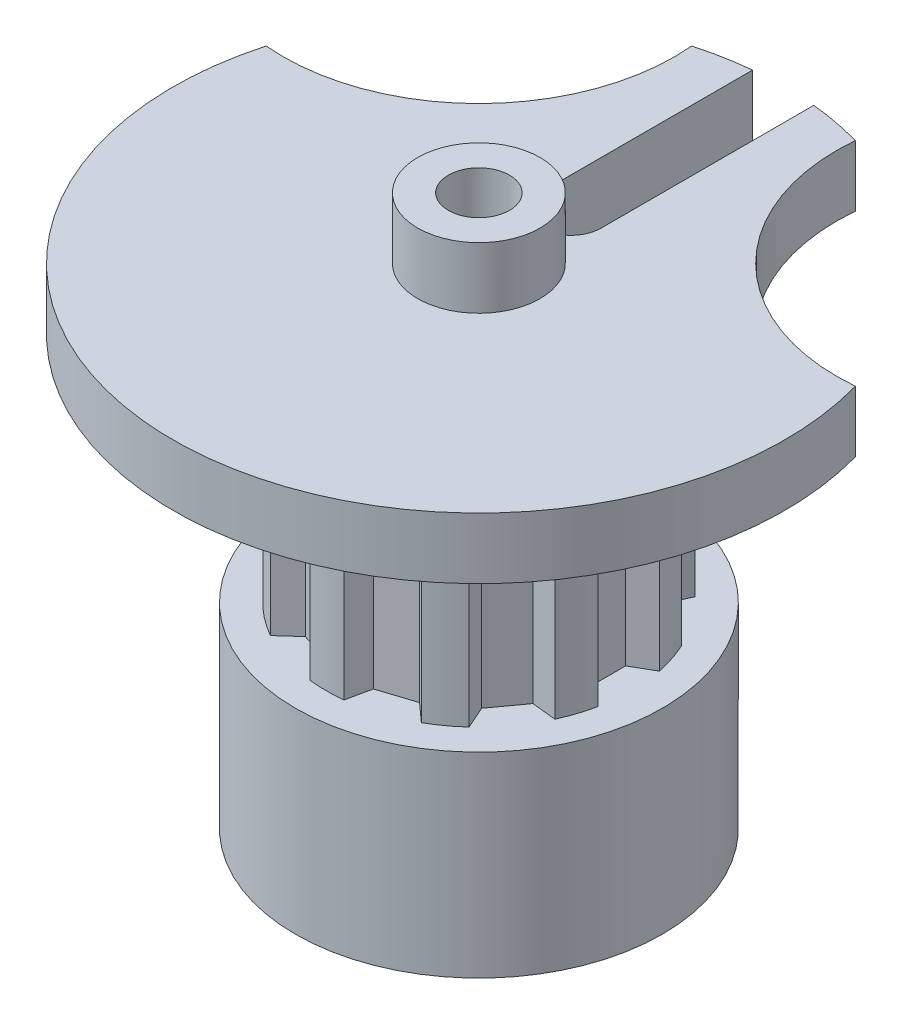
from build123d import *

# Parameters (mm, degrees)
SKETCH1_R           = 25
SKETCH1_R_2         = 2.5
BOSS_EXTRUDE1_DEPTH = 5
SKETCH2_R           = 16
CUT_EXTRUDE1_DEPTH  = 36.707142143
SKETCH3_R           = 5
SKETCH3_R_2         = 2.5
BOSS_EXTRUDE2_DEPTH = 5
BOSS_EXTRUDE3_START = 35
SKETCH4_R           = 15
SKETCH4_R_2         = 2.5
BOSS_EXTRUDE3_DEPTH = 35
CUT_EXTRUDE2_START  = -19
SKETCH5_R           = 15
CUT_EXTRUDE2_DEPTH  = 14


with BuildPart() as part:
    # Sketch1 → Boss-Extrude1 (new body)
    with BuildSketch(Plane(origin=(0, 0, 0), x_dir=(1, 0, 0), z_dir=(0, 1, 0))):
        with Locations(Location((0, 0, 0), (0, 0, 270))):
            Circle(SKETCH1_R)
        with Locations(Location((0, 0, 0), (0, 0, 270))):
            Circle(SKETCH1_R_2, mode=Mode.SUBTRACT)
    extrude(amount=BOSS_EXTRUDE1_DEPTH)

    # Sketch2 → Cut-Extrude1 (cut, through all)
    with BuildSketch(Plane(origin=(0, 5, 0), x_dir=(1, 0, 0), z_dir=(0, 1, 0))):
        with Locations((22.627416998, 22.627416998)):
            Circle(SKETCH2_R)
        with Locations((-22.627416998, 22.627416998)):
            Circle(SKETCH2_R)
        with BuildLine():
            Line((-2.5, 24.874685928), (-2.5, 7.5))
            ThreePointArc((-2.5, 7.5), (0, 5), (2.5, 7.5))
            Line((2.5, 7.5), (2.5, 24.874685928))
            ThreePointArc((2.5, 24.874685928), (0, 25), (-2.5, 24.874685928))
        make_face()
    extrude(amount=-CUT_EXTRUDE1_DEPTH, mode=Mode.SUBTRACT)

    # Sketch3 → Boss-Extrude2 (add)
    with BuildSketch(Plane(origin=(0, 5, 0), x_dir=(1, 0, 0), z_dir=(0, 1, 0))):
        with Locations(Location((0, 0, 0), (0, 0, 90))):
            Circle(SKETCH3_R)
        with Locations(Location((0, 0, 0), (0, 0, 270))):
            Circle(SKETCH3_R_2, mode=Mode.SUBTRACT)
    extrude(amount=BOSS_EXTRUDE2_DEPTH)

    # Sketch4 → Boss-Extrude3 (add)
    with BuildSketch(Plane.XZ.offset(BOSS_EXTRUDE3_START)):
        with Locations(Location((0, 0, 0), (0, 0, 260.405931773))):
            Circle(SKETCH4_R)
        with Locations(Location((0, 0, 0), (0, 0, 270))):
            Circle(SKETCH4_R_2, mode=Mode.SUBTRACT)
    extrude(amount=-BOSS_EXTRUDE3_DEPTH)

    # Sketch5 → Cut-Extrude2 (cut)
    with BuildSketch(Plane(origin=(0, 0, 0), x_dir=(1, 0, 0), z_dir=(0, 1, 0)).offset(CUT_EXTRUDE2_START)):
        with Locations(Location((0, 0, 0), (0, 0, 270))):
            Circle(SKETCH5_R)
        with BuildLine():
            Line((-10.5, 1.5), (-10.5, -1.5))
            Line((-10.5, -1.5), (-12.245822961, -2.507951357))
            ThreePointArc((-12.245822961, -2.507951357), (-11.888206454, -3.86271243), (-11.381215706, -5.16893887))
            Line((-11.381215706, -5.16893887), (-9.376356319, -4.958219658))
            Line((-9.376356319, -4.958219658), (-7.613000562, -7.385270641))
            Line((-7.613000562, -7.385270641), (-8.432942065, -9.226889407))
            ThreePointArc((-8.432942065, -9.226889407), (-7.347315654, -10.11271243), (-6.169370885, -10.871470134))
            Line((-6.169370885, -10.871470134), (-4.671263215, -9.52256793))
            Line((-4.671263215, -9.52256793), (-1.818093666, -10.449618913))
            Line((-1.818093666, -10.449618913), (-1.398963925, -12.421469315))
            ThreePointArc((-1.398963925, -12.421469315), (0, -12.5), (1.398963925, -12.421469315))
            Line((1.398963925, -12.421469315), (1.818093666, -10.449618913))
            Line((1.818093666, -10.449618913), (4.671263215, -9.52256793))
            Line((4.671263215, -9.52256793), (6.169370885, -10.871470134))
            ThreePointArc((6.169370885, -10.871470134), (7.347315654, -10.11271243), (8.432942065, -9.226889407))
            Line((8.432942065, -9.226889407), (7.613000562, -7.385270641))
            Line((7.613000562, -7.385270641), (9.376356319, -4.958219658))
            Line((9.376356319, -4.958219658), (11.381215706, -5.16893887))
            ThreePointArc((11.381215706, -5.16893887), (11.888206454, -3.86271243), (12.245822961, -2.507951357))
            Line((12.245822961, -2.507951357), (10.5, -1.5))
            Line((10.5, -1.5), (10.5, 1.5))
            Line((10.5, 1.5), (12.245822961, 2.507951357))
            ThreePointArc((12.245822961, 2.507951357), (11.888206454, 3.86271243), (11.381215706, 5.16893887))
            Line((11.381215706, 5.16893887), (9.376356319, 4.958219658))
            Line((9.376356319, 4.958219658), (7.613000562, 7.385270641))
            Line((7.613000562, 7.385270641), (8.432942065, 9.226889407))
            ThreePointArc((8.432942065, 9.226889407), (7.347315654, 10.11271243), (6.169370885, 10.871470134))
            Line((6.169370885, 10.871470134), (4.671263215, 9.52256793))
            Line((4.671263215, 9.52256793), (1.818093666, 10.449618913))
            Line((1.818093666, 10.449618913), (1.398963925, 12.421469315))
            ThreePointArc((1.398963925, 12.421469315), (0, 12.5), (-1.398963925, 12.421469315))
            Line((-1.398963925, 12.421469315), (-1.818093666, 10.449618913))
            Line((-1.818093666, 10.449618913), (-4.671263215, 9.52256793))
            Line((-4.671263215, 9.52256793), (-6.169370885, 10.871470134))
            ThreePointArc((-6.169370885, 10.871470134), (-7.347315654, 10.11271243), (-8.432942065, 9.226889407))
            Line((-8.432942065, 9.226889407), (-7.613000562, 7.385270641))
            Line((-7.613000562, 7.385270641), (-9.376356319, 4.958219658))
            Line((-9.376356319, 4.958219658), (-11.381215706, 5.16893887))
            ThreePointArc((-11.381215706, 5.16893887), (-11.888206454, 3.86271243), (-12.245822961, 2.507951357))
            Line((-12.245822961, 2.507951357), (-10.5, 1.5))
        make_face(mode=Mode.SUBTRACT)
    extrude(amount=CUT_EXTRUDE2_DEPTH, mode=Mode.SUBTRACT)


solid = part.part
